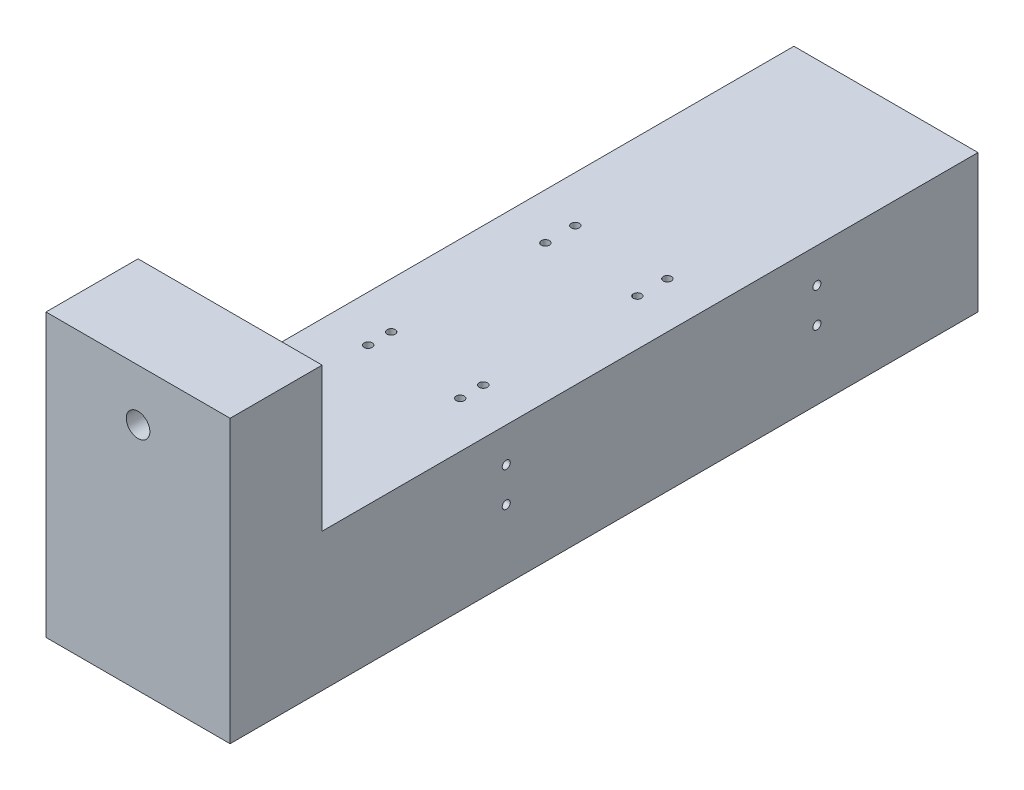
from build123d import *

# Parameters (mm, degrees)
SKETCH1_W                    = 160
SKETCH1_H                    = 120
BOSS_EXTRUDE3_DEPTH          = 570
SKETCH4_W                    = 160
SKETCH4_H                    = 245
BOSS_EXTRUDE4_DEPTH          = 80
F_20_5_20_5_DIAMETER_HOLE1_D = 20.5
M8X1_0_TAPPED_HOLE2_D        = 7
M8X1_0_TAPPED_HOLE2_DEPTH    = 20
M8X1_0_TAPPED_HOLE2_TIP      = 2.103012167
M8X1_0_TAPPED_HOLE3_D        = 7
M8X1_0_TAPPED_HOLE3_DEPTH    = 20
M8X1_0_TAPPED_HOLE3_TIP      = 2.103012167
M8X1_0_TAPPED_HOLE1_D        = 7
M8X1_0_TAPPED_HOLE1_DEPTH    = 20
M8X1_0_TAPPED_HOLE1_TIP      = 2.103012167
M12_TAPPED_HOLE1_D           = 10.2
M12_TAPPED_HOLE1_DEPTH       = 30
M12_TAPPED_HOLE1_TIP         = 3.064389157


with BuildPart() as part:
    # Sketch1 → Boss-Extrude3 (new body)
    with BuildSketch(Plane.XY):
        with Locations((0, 89.618320611)):
            Rectangle(SKETCH1_W, SKETCH1_H)
    extrude(amount=BOSS_EXTRUDE3_DEPTH)

    # Sketch4 → Boss-Extrude4 (add)
    with BuildSketch(Plane.XY.offset(570)):
        with Locations((0, 152.118320611)):
            Rectangle(SKETCH4_W, SKETCH4_H)
    extrude(amount=BOSS_EXTRUDE4_DEPTH)

    # Ø20.5 (20.5) Diameter Hole1 (through all)
    with Locations(Plane.XY.offset(650)):
        with Locations((0, 229.618320611)):
            Hole(F_20_5_20_5_DIAMETER_HOLE1_D / 2)

    # M8x1.0 Tapped Hole2
    with Locations(Plane(origin=(0, 149.618320611, 0), x_dir=(1, 0, 0), z_dir=(0, 1, 0))):
        with Locations((-40, -230), (40, -410), (40, -390), (40, -256), (40, -230), (-40, -410), (-40, -390), (-40, -256)):
            Hole(M8X1_0_TAPPED_HOLE2_D / 2, depth=M8X1_0_TAPPED_HOLE2_DEPTH)
            with Locations((0, 0, -(M8X1_0_TAPPED_HOLE2_DEPTH + M8X1_0_TAPPED_HOLE2_TIP / 2))):  # 118° drill point
                Cone(0, M8X1_0_TAPPED_HOLE2_D / 2, M8X1_0_TAPPED_HOLE2_TIP, mode=Mode.SUBTRACT)

    # M8x1.0 Tapped Hole3
    with Locations(Plane(origin=(80, 119.618320611, 140), x_dir=(0, 0, 1), z_dir=(1, 0, 0))):
        with Locations((0, 0), (0, 30), (270, 0), (270, 30)):
            Hole(M8X1_0_TAPPED_HOLE3_D / 2, depth=M8X1_0_TAPPED_HOLE3_DEPTH)
            with Locations((0, 0, -(M8X1_0_TAPPED_HOLE3_DEPTH + M8X1_0_TAPPED_HOLE3_TIP / 2))):  # 118° drill point
                Cone(0, M8X1_0_TAPPED_HOLE3_D / 2, M8X1_0_TAPPED_HOLE3_TIP, mode=Mode.SUBTRACT)

    # M8x1.0 Tapped Hole1
    with Locations(Plane.ZY.offset(80)):
        with Locations((410, 119.618320611), (140, 89.618320611), (410, 89.618320611), (140, 119.618320611)):
            Hole(M8X1_0_TAPPED_HOLE1_D / 2, depth=M8X1_0_TAPPED_HOLE1_DEPTH)
            with Locations((0, 0, -(M8X1_0_TAPPED_HOLE1_DEPTH + M8X1_0_TAPPED_HOLE1_TIP / 2))):  # 118° drill point
                Cone(0, M8X1_0_TAPPED_HOLE1_D / 2, M8X1_0_TAPPED_HOLE1_TIP, mode=Mode.SUBTRACT)

    # M12 Tapped Hole1
    with Locations(Plane(origin=(0, 0, 0), x_dir=(-1, 0, 0), z_dir=(0, 0, -1))):
        with Locations((-50, 119.618320611), (50, 119.618320611), (50, 59.618320611), (-50, 59.618320611)):
            Hole(M12_TAPPED_HOLE1_D / 2, depth=M12_TAPPED_HOLE1_DEPTH)
            with Locations((0, 0, -(M12_TAPPED_HOLE1_DEPTH + M12_TAPPED_HOLE1_TIP / 2))):  # 118° drill point
                Cone(0, M12_TAPPED_HOLE1_D / 2, M12_TAPPED_HOLE1_TIP, mode=Mode.SUBTRACT)


solid = part.part
